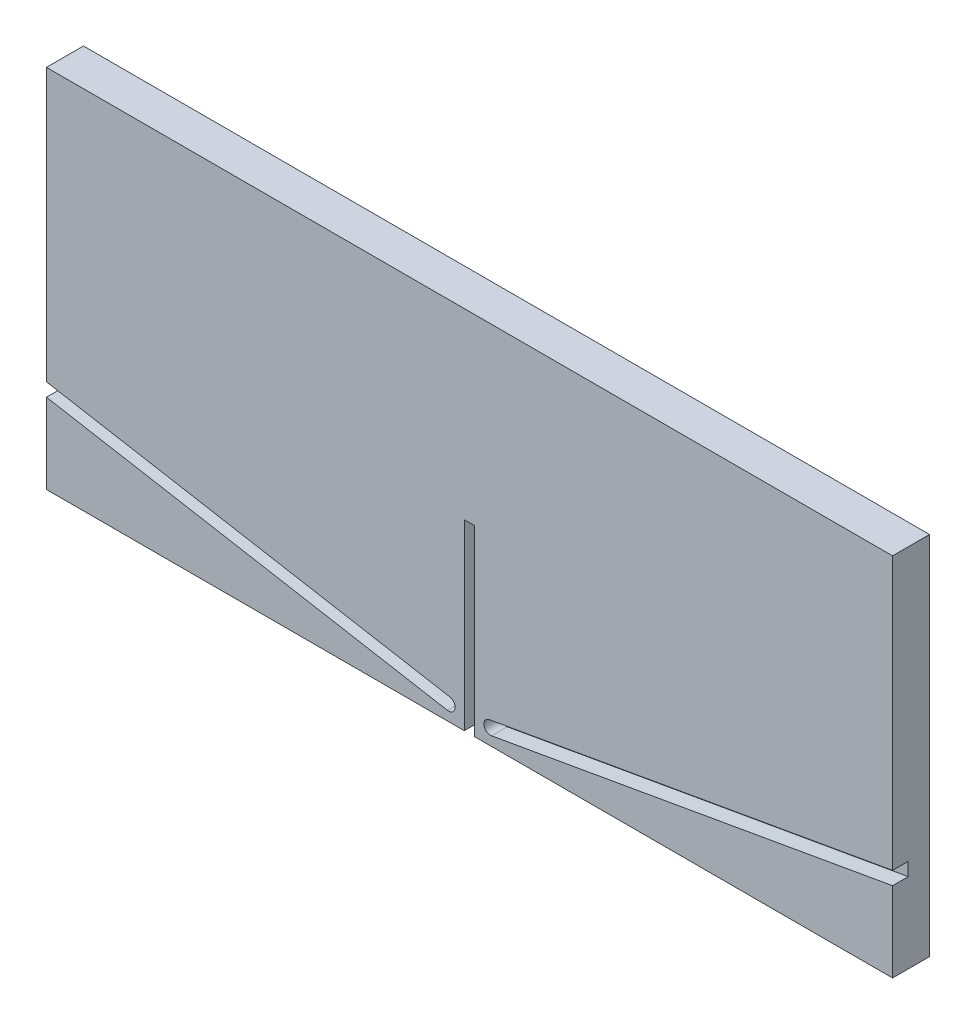
from build123d import *

# Parameters (mm, degrees)
SKETCH1_W           = 205.74
SKETCH1_H           = 88.9
BOSS_EXTRUDE1_DEPTH = 8.9916
SKETCH2_W           = 2.54
SKETCH2_H           = 44.45
CUT_EXTRUDE1_DEPTH  = 8.9916
CUT_EXTRUDE3_DEPTH  = 3.81


with BuildPart() as part:
    # Sketch1 → Boss-Extrude1 (new body)
    with BuildSketch(Plane.XY):
        Rectangle(SKETCH1_W, SKETCH1_H)
    extrude(amount=BOSS_EXTRUDE1_DEPTH)

    # Sketch2 → Cut-Extrude1 (cut)
    with BuildSketch(Plane.XY.offset(8.9916)):
        with Locations((0, -22.225)):
            Rectangle(SKETCH2_W, SKETCH2_H)
    extrude(amount=-CUT_EXTRUDE1_DEPTH, mode=Mode.SUBTRACT)

    # Sketch4 → Cut-Extrude3 (cut)
    with BuildSketch(Plane.XY.offset(8.9916)):
        with BuildLine():
            Line((-200.384333518, -4.590586805), (-4.804333518, -39.076617692))
            ThreePointArc((-4.804333518, -39.076617692), (-3.516617692, -40.915666482), (-5.355666482, -42.203382308))
            Line((-5.355666482, -42.203382308), (-200.935666482, -7.717351421))
            ThreePointArc((-200.935666482, -7.717351421), (-202.223382308, -5.878302631), (-200.384333518, -4.590586805))
        make_face()
        with BuildLine():
            Line((200.384333518, -4.590586805), (4.804333518, -39.076617692))
            ThreePointArc((4.804333518, -39.076617692), (3.516617692, -40.915666482), (5.355666482, -42.203382308))
            Line((5.355666482, -42.203382308), (200.935666482, -7.717351421))
            ThreePointArc((200.935666482, -7.717351421), (202.223382308, -5.878302631), (200.384333518, -4.590586805))
        make_face()
    extrude(amount=-CUT_EXTRUDE3_DEPTH, mode=Mode.SUBTRACT)


solid = part.part
